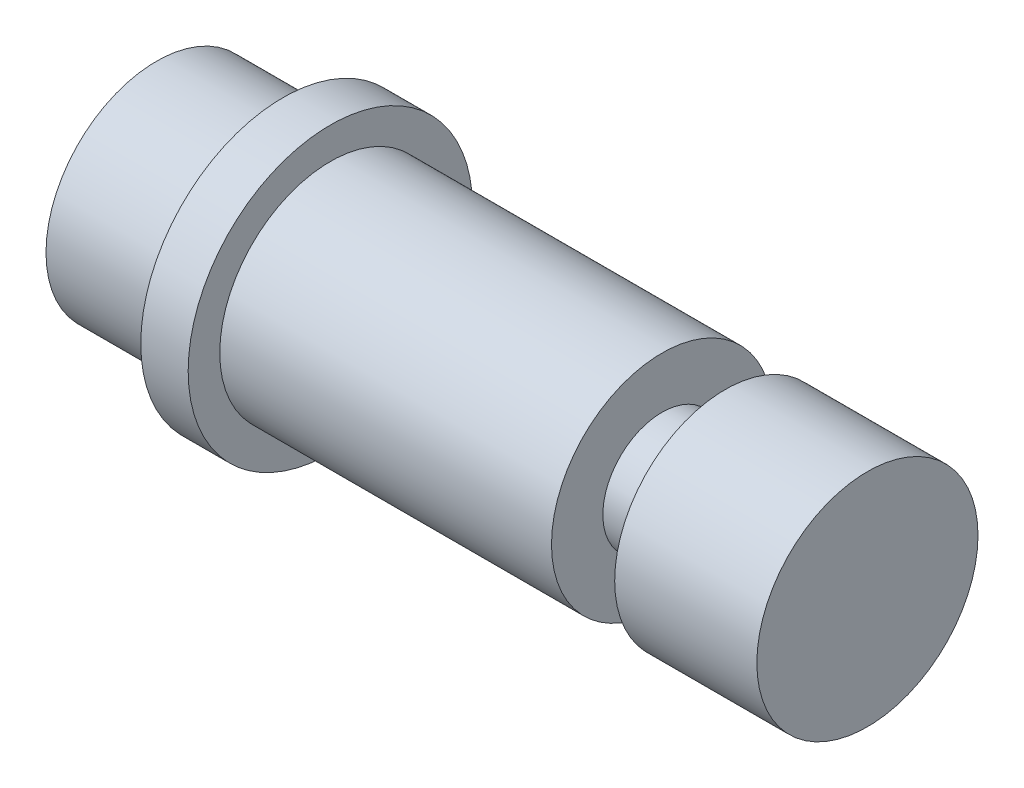
from build123d import *


with BuildPart() as part:
    # Croquis1 → Revolución1 (revolve)
    with BuildSketch(Plane.XY, mode=Mode.PRIVATE) as revoluci_n1_sk:
        Polygon((0, 7), (0, 0), (45, 0), (45, 7), (36, 7), (36, 3.75), (32, 3.75), (32, 7), (11, 7), (11, 9), (8, 9), (8, 7), align=None)
    revolve(revoluci_n1_sk.sketch.rotate(Axis((0, 0, 0), (-1, 0, 0)), 90), axis=Axis((0, 0, 0), (-1, 0, 0)))


solid = part.part
